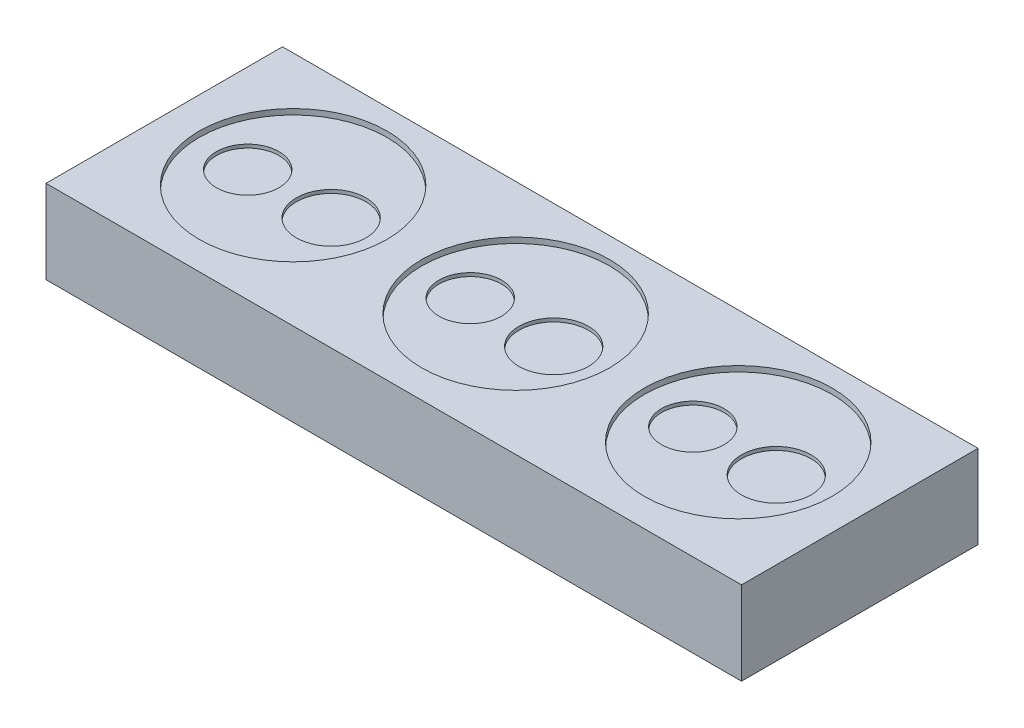
from build123d import *

# Parameters (mm, degrees)
SKETCH1_W           = 500
SKETCH1_H           = 170
BOSS_EXTRUDE1_DEPTH = 60
SKETCH3_R           = 67.5
CUT_EXTRUDE1_DEPTH  = 4
SKETCH4_R           = 25
SKETCH4_R_2         = 22.5
CUT_EXTRUDE2_DEPTH  = 2.5


with BuildPart() as part:
    # Sketch1 → Boss-Extrude1 (new body)
    with BuildSketch(Plane(origin=(0, 0, 0), x_dir=(1, 0, 0), z_dir=(0, 1, 0))):
        with Locations((-5.514705882, 23.455882353)):
            Rectangle(SKETCH1_W, SKETCH1_H)
    extrude(amount=BOSS_EXTRUDE1_DEPTH)

    # Sketch3 → Cut-Extrude1 (cut)
    with BuildSketch(Plane(origin=(0, 60, 0), x_dir=(1, 0, 0), z_dir=(0, 1, 0))):
        with Locations(Location((-5.514705882, 26.094123359, 0), (0, 0, 270))):
            Circle(SKETCH3_R)
        with Locations(Location((154.485294118, 26.094123359, 0), (0, 0, 270))):
            Circle(SKETCH3_R)
        with Locations(Location((-165.514705882, 26.094123359, 0), (0, 0, 270))):
            Circle(SKETCH3_R)
    extrude(amount=-CUT_EXTRUDE1_DEPTH, mode=Mode.SUBTRACT)

    # Sketch4 → Cut-Extrude2 (cut)
    with BuildSketch(Plane(origin=(0, 56, 0), x_dir=(1, 0, 0), z_dir=(0, 1, 0))):
        with Locations(Location((-135.514705882, 23.455882353, 0), (0, 0, 270))):
            Circle(SKETCH4_R)
        with Locations(Location((-195.514705882, 23.455882353, 0), (0, 0, 270))):
            Circle(SKETCH4_R_2)
        with Locations(Location((-35.514705882, 23.455882353, 0), (0, 0, 270))):
            Circle(SKETCH4_R_2)
        with Locations(Location((24.485294118, 23.455882353, 0), (0, 0, 270))):
            Circle(SKETCH4_R)
        with Locations(Location((124.485294118, 23.455882353, 0), (0, 0, 270))):
            Circle(SKETCH4_R_2)
        with Locations(Location((184.485294118, 23.455882353, 0), (0, 0, 270))):
            Circle(SKETCH4_R)
    extrude(amount=-CUT_EXTRUDE2_DEPTH, mode=Mode.SUBTRACT)


solid = part.part
